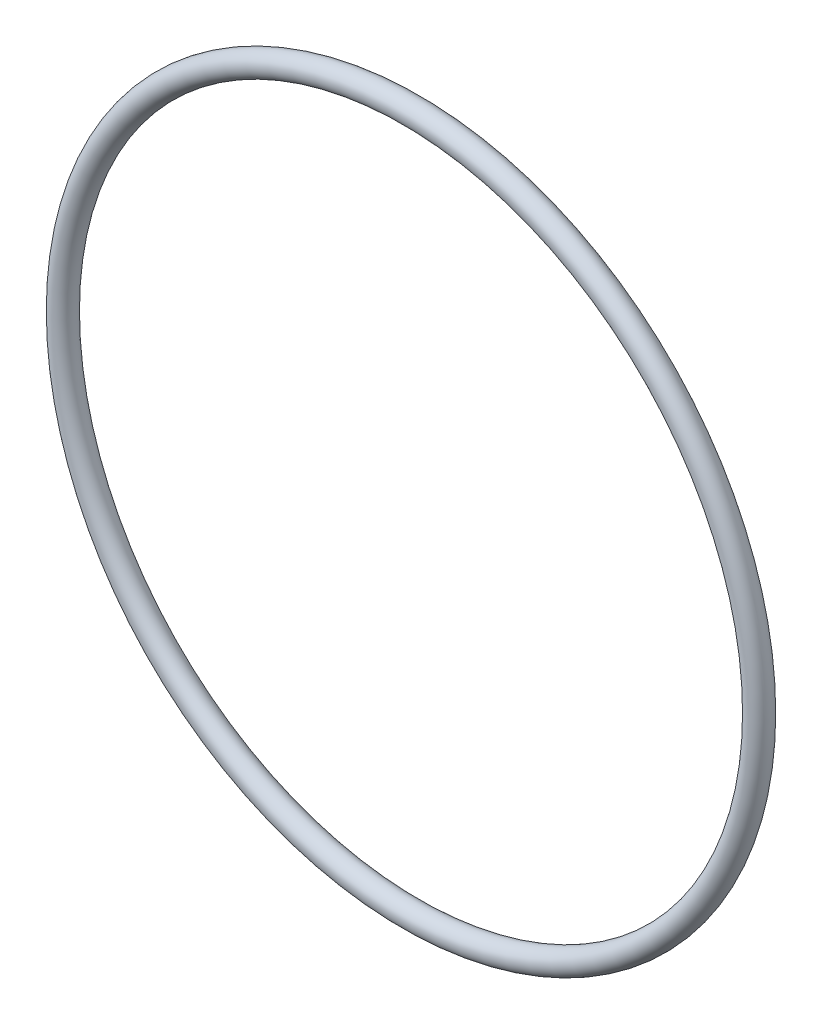
from build123d import *

# Parameters (mm, degrees)
SKETCH1_R = 1.7653


with BuildPart() as part:
    # Sketch1 → Revolve1 (revolve)
    with BuildSketch(Plane(origin=(0, 0, 0), x_dir=(0, -1, 0), z_dir=(1, 0, 0)), mode=Mode.PRIVATE) as revolve1_sk:
        with Locations((52.3621, 0)):
            Circle(SKETCH1_R)
    revolve(revolve1_sk.sketch.rotate(Axis((0, 0, 1.7653), (0, 0, -1)), 270), axis=Axis((0, 0, 1.7653), (0, 0, -1)))


solid = part.part
